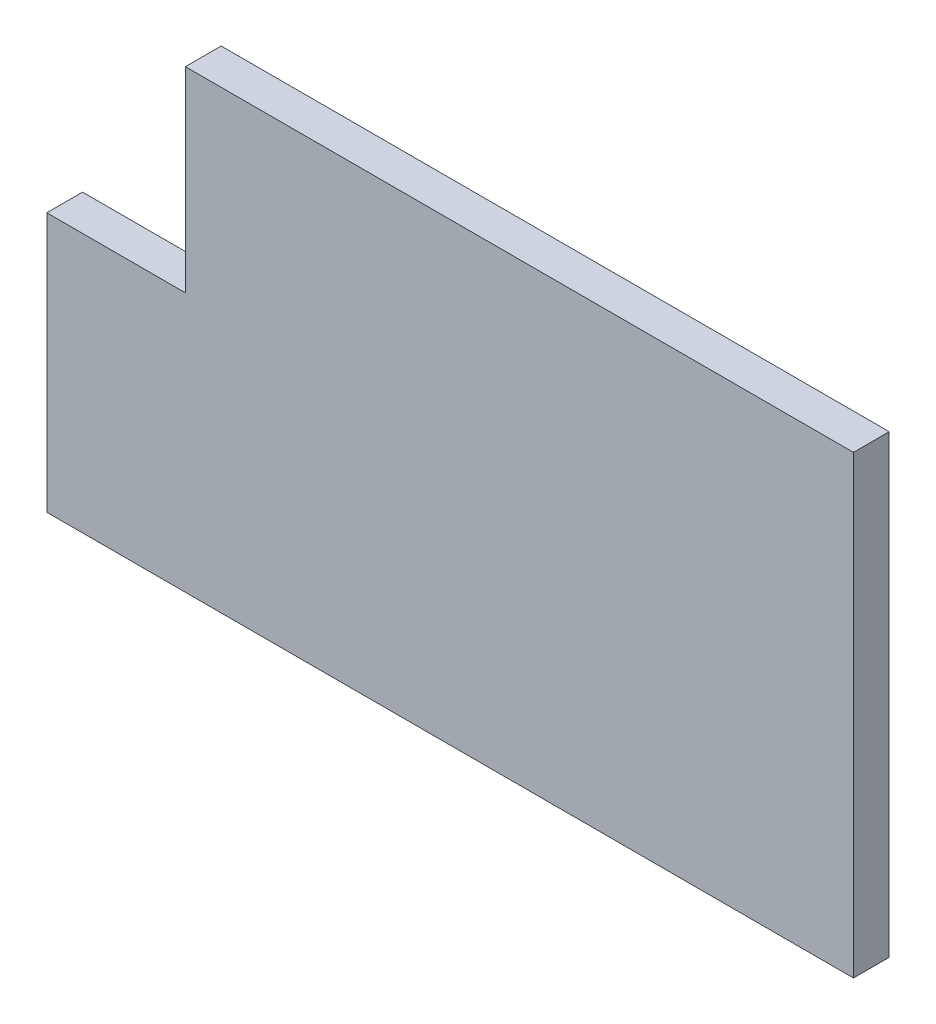
from build123d import *

# Parameters (mm, degrees)
EXTRUDE_1_DEPTH = 400


with BuildPart() as part:
    # Эскиз1 → Бобышка-Вытянуть1 (new body)
    with BuildSketch(Plane.XY):
        Polygon((906.35402749, 2129.285994672), (7776.35402749, 2129.285994672), (8076.35402749, 2129.285994672), (8076.35402749, -2660.714005328), (8076.35402749, -2960.714005328), (-643.64597251, -2960.714005328), (-943.64597251, -2960.714005328), (-943.64597251, -360.714005328), (-943.64597251, -60.714005328), (606.35402749, -60.714005328), (606.35402749, 2129.285994672), align=None)
    extrude(amount=EXTRUDE_1_DEPTH)


solid = part.part
